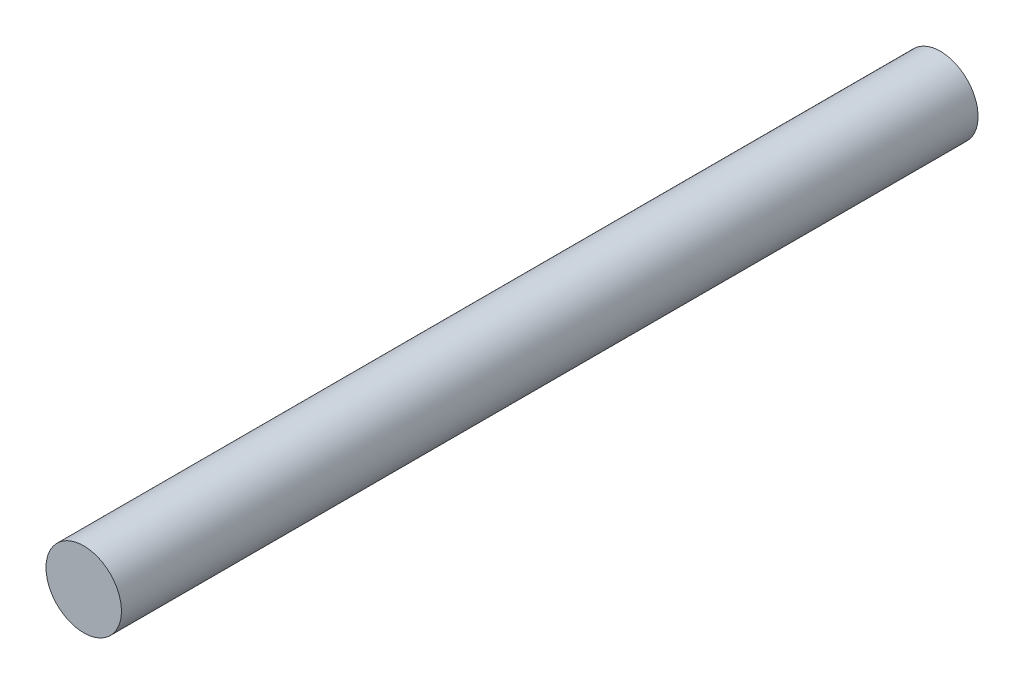
from build123d import *

# Parameters (mm, degrees)
SKETCH_1_R      = 3.5
EXTRUDE_1_DEPTH = 79.5


with BuildPart() as part:
    # 草图1 → 凸台-拉伸1 (new body)
    with BuildSketch(Plane.XY):
        with Locations(Location((0, 0, 0), (0, 0, 180))):
            Circle(SKETCH_1_R)
    extrude(amount=EXTRUDE_1_DEPTH)


solid = part.part
